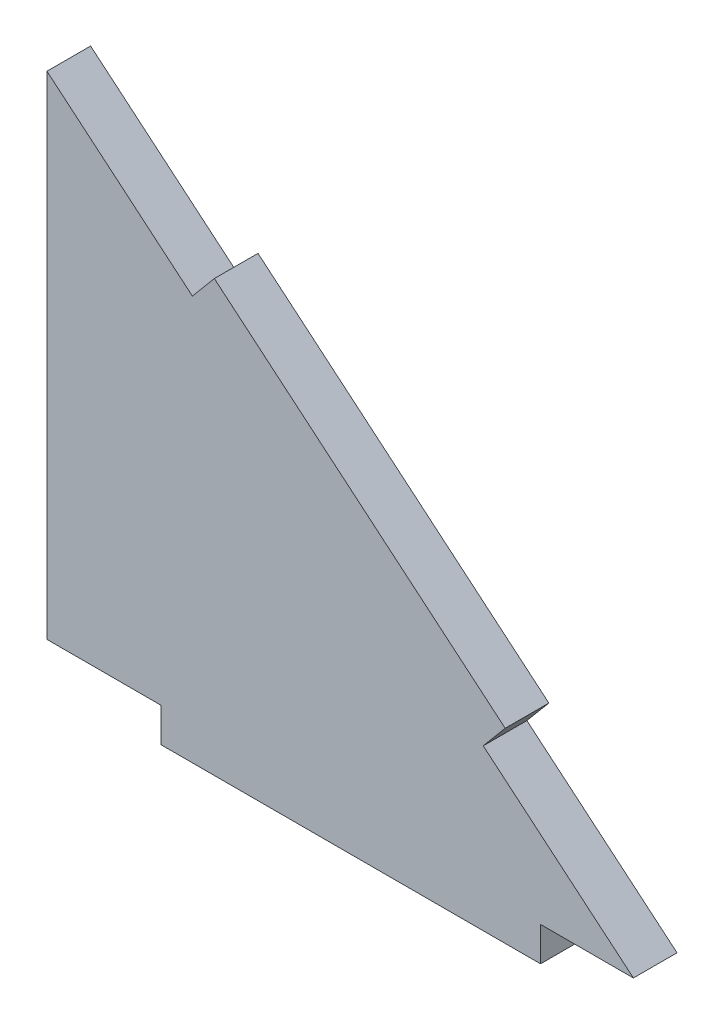
from build123d import *

# Parameters (mm, degrees)
EXTRUDE_1_DEPTH = 4.6


with BuildPart() as part:
    # 草图1 → 凸台-拉伸1 (new body)
    with BuildSketch(Plane.XY):
        Polygon((-23.020433608, 5.056034895), (-23.020433608, 8.656034895), (-35.020433608, 8.656034895), (-35.020433608, 60.496855616), (-19.699544746, 47.641103423), (-17.385509351, 50.398863418), (13.256268374, 24.687359031), (10.942232979, 21.929599035), (24.83868432, 10.26909184), (25.702528361, 9.544240624), (26.761050729, 8.656034895), (16.979566392, 8.656034895), (16.979566392, 5.056034895), align=None)
    extrude(amount=EXTRUDE_1_DEPTH)


solid = part.part
